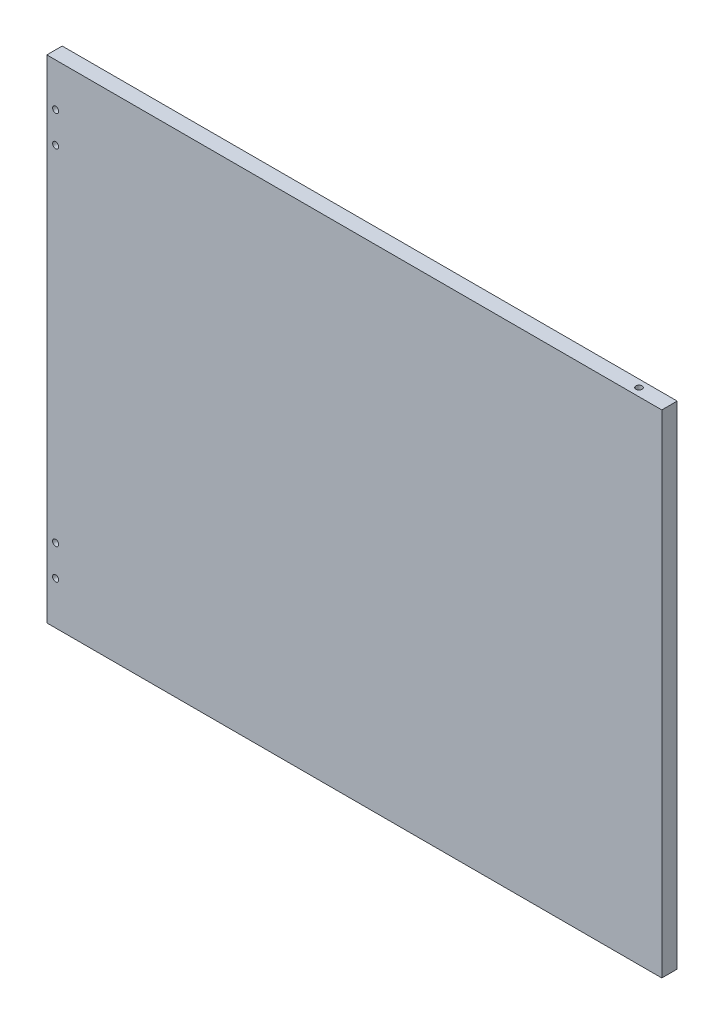
from build123d import *

# Parameters (mm, degrees)
SZKIC1_W                    = 1000
SZKIC1_H                    = 800
DODANIE_WYCI_GNI_CIE1_DEPTH = 25
SZKIC2_R                    = 5
WYTNIJ_WYCI_GNI_CIE3_DEPTH  = 25
SZKIC4_R                    = 5
WYTNIJ_WYCI_GNI_CIE4_DEPTH  = 40


with BuildPart() as part:
    # Szkic1 → Dodanie-wyciągnięcie1 (new body)
    with BuildSketch(Plane.XY):
        with Locations((500, 400)):
            Rectangle(SZKIC1_W, SZKIC1_H)
    extrude(amount=DODANIE_WYCI_GNI_CIE1_DEPTH)

    # Szkic2 → Wytnij-wyciągnięcie3 (cut)
    with BuildSketch(Plane.XY):
        with Locations((14.35, 730)):
            Circle(SZKIC2_R)
        with Locations((14.35, 680)):
            Circle(SZKIC2_R)
        with Locations((14.35, 70)):
            Circle(SZKIC2_R)
        with Locations((14.35, 120)):
            Circle(SZKIC2_R)
    extrude(amount=WYTNIJ_WYCI_GNI_CIE3_DEPTH, mode=Mode.SUBTRACT)

    # Szkic4 → Wytnij-wyciągnięcie4 (cut)
    with BuildSketch(Plane(origin=(0, 0, 0), x_dir=(1, 0, 0), z_dir=(0, 1, 0))):
        with Locations(Location((950, -12, 0), (0, 0, 270))):
            Circle(SZKIC4_R)
    wytnij_wyci_gni_cie4 = extrude(amount=WYTNIJ_WYCI_GNI_CIE4_DEPTH, mode=Mode.SUBTRACT)

    # Lustro2: Wytnij-wyciągnięcie4 across plane
    add(wytnij_wyci_gni_cie4.mirror(Plane.ZX.offset(400)), mode=Mode.SUBTRACT)


solid = part.part
